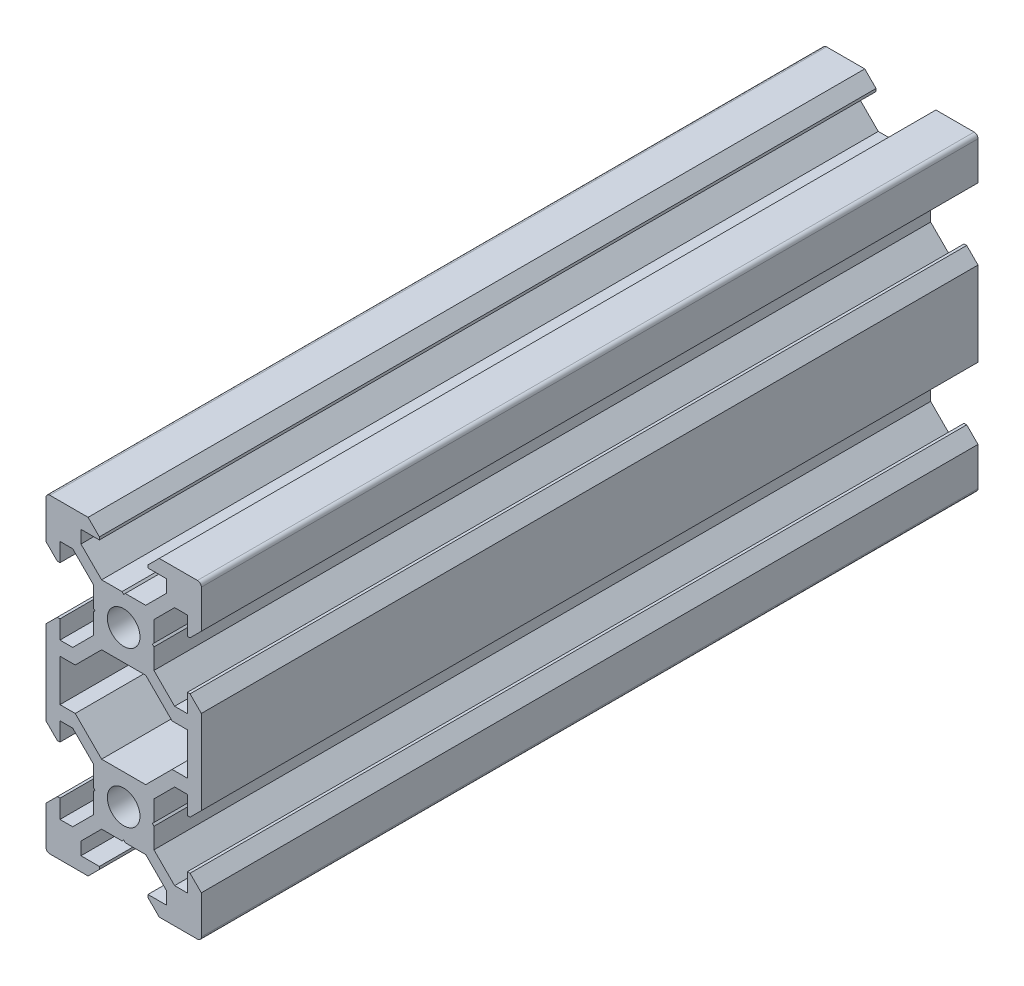
from build123d import *

# Parameters (mm, degrees)
SKETCH1_R           = 2.1
BOSS_EXTRUDE1_DEPTH = 100


with BuildPart() as part:
    # Sketch1 → Boss-Extrude1 (new body)
    with BuildSketch(Plane.XY):
        with BuildLine():
            Line((4.58, -20), (9.5, -20))
            ThreePointArc((9.5, -20), (9.853553391, -19.853553391), (10, -19.5))
            Line((10, -19.5), (10, -14.58))
            Line((10, -14.58), (8.545, -13.125))
            Line((8.545, -13.125), (8.2, -13.125))
            Line((8.2, -13.125), (8.2, -15.5))
            Line((8.2, -15.5), (6.560660172, -15.5))
            Line((6.560660172, -15.5), (3.9, -12.839339828))
            Line((3.9, -12.839339828), (3.9, -10.21))
            Line((3.9, -10.21), (3.69, -10))
            Line((3.69, -10), (3.9, -9.79))
            Line((3.9, -9.79), (3.9, -7.160660172))
            Line((3.9, -7.160660172), (6.560660172, -4.5))
            Line((6.560660172, -4.5), (8.2, -4.5))
            Line((8.2, -4.5), (8.2, -6.875))
            Line((8.2, -6.875), (8.545, -6.875))
            Line((8.545, -6.875), (10, -5.42))
            Line((10, -5.42), (10, 5.42))
            Line((10, 5.42), (8.545, 6.875))
            Line((8.545, 6.875), (8.2, 6.875))
            Line((8.2, 6.875), (8.2, 4.5))
            Line((8.2, 4.5), (6.560660172, 4.5))
            Line((6.560660172, 4.5), (3.9, 7.160660172))
            Line((3.9, 7.160660172), (3.9, 9.79))
            Line((3.9, 9.79), (3.69, 10))
            Line((3.69, 10), (3.9, 10.21))
            Line((3.9, 10.21), (3.9, 12.839339828))
            Line((3.9, 12.839339828), (6.560660172, 15.5))
            Line((6.560660172, 15.5), (8.2, 15.5))
            Line((8.2, 15.5), (8.2, 13.125))
            Line((8.2, 13.125), (8.545, 13.125))
            Line((8.545, 13.125), (10, 14.58))
            Line((10, 14.58), (10, 19.5))
            ThreePointArc((10, 19.5), (9.853553391, 19.853553391), (9.5, 20))
            Line((9.5, 20), (4.58, 20))
            Line((4.58, 20), (3.125, 18.545))
            Line((3.125, 18.545), (3.125, 18.2))
            Line((3.125, 18.2), (5.5, 18.2))
            Line((5.5, 18.2), (5.5, 16.560660172))
            Line((5.5, 16.560660172), (2.839339828, 13.9))
            Line((2.839339828, 13.9), (0.21, 13.9))
            Line((0.21, 13.9), (0, 13.69))
            Line((0, 13.69), (-0.21, 13.9))
            Line((-0.21, 13.9), (-2.839339828, 13.9))
            Line((-2.839339828, 13.9), (-5.5, 16.560660172))
            Line((-5.5, 16.560660172), (-5.5, 18.2))
            Line((-5.5, 18.2), (-3.125, 18.2))
            Line((-3.125, 18.2), (-3.125, 18.545))
            Line((-3.125, 18.545), (-4.58, 20))
            Line((-4.58, 20), (-9.5, 20))
            ThreePointArc((-9.5, 20), (-9.853553391, 19.853553391), (-10, 19.5))
            Line((-10, 19.5), (-10, 14.58))
            Line((-10, 14.58), (-8.545, 13.125))
            Line((-8.545, 13.125), (-8.2, 13.125))
            Line((-8.2, 13.125), (-8.2, 15.5))
            Line((-8.2, 15.5), (-6.560660172, 15.5))
            Line((-6.560660172, 15.5), (-3.9, 12.839339828))
            Line((-3.9, 12.839339828), (-3.9, 10.21))
            Line((-3.9, 10.21), (-3.69, 10))
            Line((-3.69, 10), (-3.9, 9.79))
            Line((-3.9, 9.79), (-3.9, 7.160660172))
            Line((-3.9, 7.160660172), (-6.560660172, 4.5))
            Line((-6.560660172, 4.5), (-8.2, 4.5))
            Line((-8.2, 4.5), (-8.2, 6.875))
            Line((-8.2, 6.875), (-8.545, 6.875))
            Line((-8.545, 6.875), (-10, 5.42))
            Line((-10, 5.42), (-10, -5.42))
            Line((-10, -5.42), (-8.545, -6.875))
            Line((-8.545, -6.875), (-8.2, -6.875))
            Line((-8.2, -6.875), (-8.2, -4.5))
            Line((-8.2, -4.5), (-6.560660172, -4.5))
            Line((-6.560660172, -4.5), (-3.9, -7.160660172))
            Line((-3.9, -7.160660172), (-3.9, -9.79))
            Line((-3.9, -9.79), (-3.69, -10))
            Line((-3.69, -10), (-3.9, -10.21))
            Line((-3.9, -10.21), (-3.9, -12.839339828))
            Line((-3.9, -12.839339828), (-6.560660172, -15.5))
            Line((-6.560660172, -15.5), (-8.2, -15.5))
            Line((-8.2, -15.5), (-8.2, -13.125))
            Line((-8.2, -13.125), (-8.545, -13.125))
            Line((-8.545, -13.125), (-10, -14.58))
            Line((-10, -14.58), (-10, -19.5))
            ThreePointArc((-10, -19.5), (-9.853553391, -19.853553391), (-9.5, -20))
            Line((-9.5, -20), (-4.58, -20))
            Line((-4.58, -20), (-3.125, -18.545))
            Line((-3.125, -18.545), (-3.125, -18.2))
            Line((-3.125, -18.2), (-5.5, -18.2))
            Line((-5.5, -18.2), (-5.5, -16.560660172))
            Line((-5.5, -16.560660172), (-2.839339828, -13.9))
            Line((-2.839339828, -13.9), (-0.21, -13.9))
            Line((-0.21, -13.9), (0, -13.69))
            Line((0, -13.69), (0.21, -13.9))
            Line((0.21, -13.9), (2.839339828, -13.9))
            Line((2.839339828, -13.9), (5.5, -16.560660172))
            Line((5.5, -16.560660172), (5.5, -18.2))
            Line((5.5, -18.2), (3.125, -18.2))
            Line((3.125, -18.2), (3.125, -18.545))
            Line((3.125, -18.545), (4.58, -20))
        make_face()
        with Locations((0, -10)):
            Circle(SKETCH1_R, mode=Mode.SUBTRACT)
        Polygon((-6.239339828, -2.7), (-8.2, -2.7), (-8.2, 2.7), (-6.239339828, 2.7), (-2.839339828, 6.1), (2.839339828, 6.1), (6.239339828, 2.7), (8.2, 2.7), (8.2, -2.7), (6.239339828, -2.7), (2.839339828, -6.1), (-2.839339828, -6.1), align=None, mode=Mode.SUBTRACT)
        with Locations((0, 10)):
            Circle(SKETCH1_R, mode=Mode.SUBTRACT)
    extrude(amount=BOSS_EXTRUDE1_DEPTH)


solid = part.part
